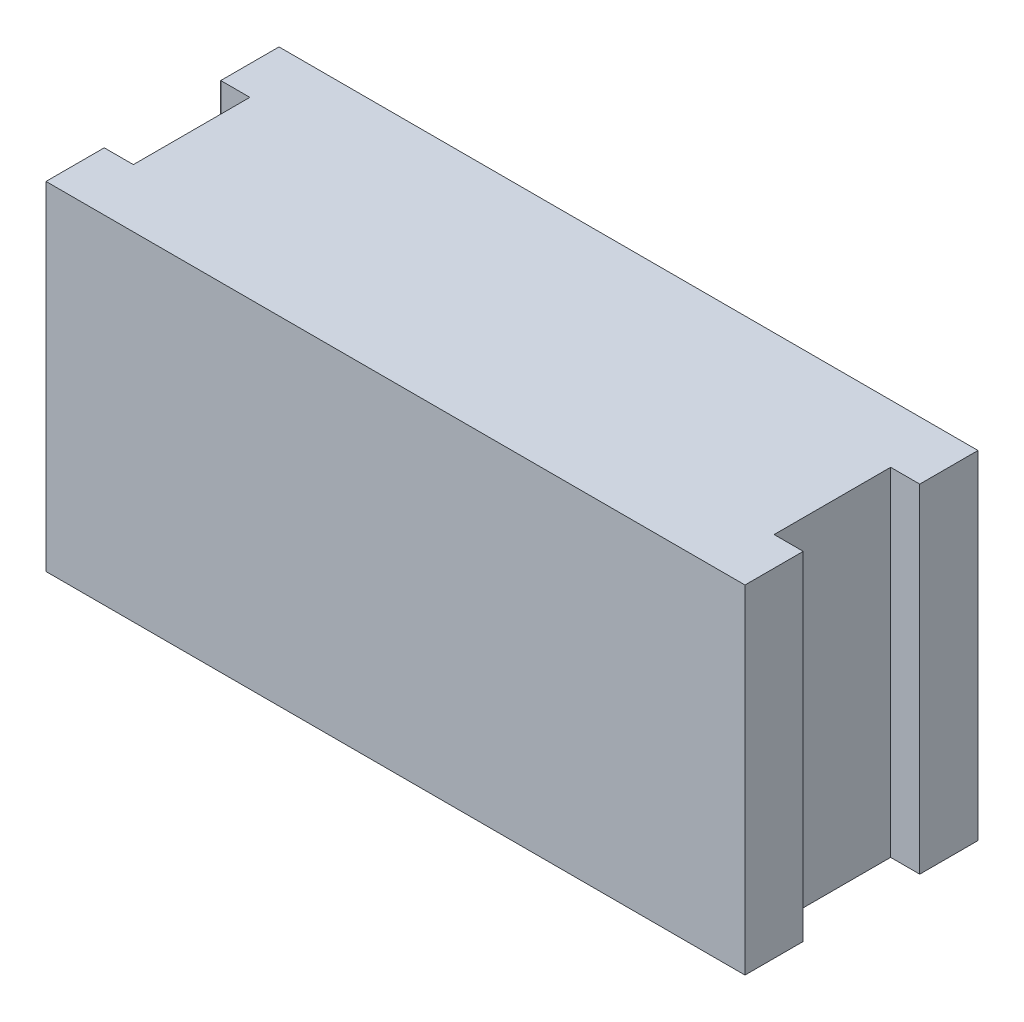
from build123d import *

# Parameters (mm, degrees)
EXTRUDE_1_DEPTH = 580


with BuildPart() as part:
    # Эскиз1 → Бобышка-Вытянуть1 (new body)
    with BuildSketch(Plane(origin=(0, 0, 0), x_dir=(1, 0, 0), z_dir=(0, 1, 0))):
        Polygon((-600, 200), (600, 200), (600, 100), (550, 100), (550, -100), (600, -100), (600, -200), (-600, -200), (-600, -100), (-550, -100), (-550, 100), (-600, 100), align=None)
    extrude(amount=EXTRUDE_1_DEPTH)


solid = part.part
